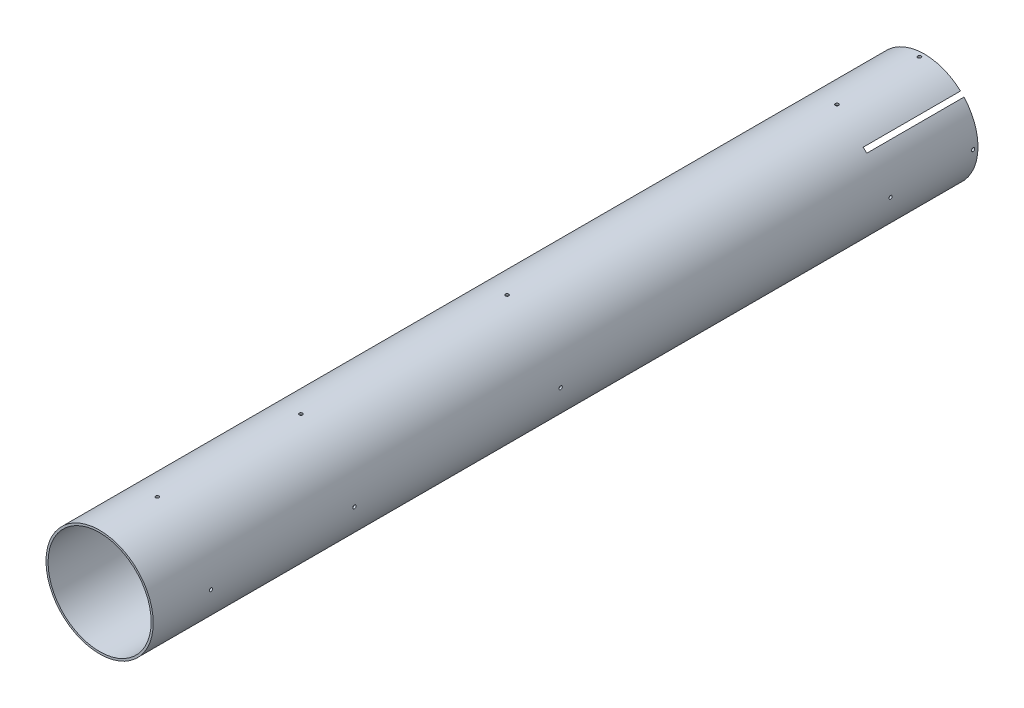
from build123d import *

# Parameters (mm, degrees)
SKETCH1_R           = 65
SKETCH1_R_2         = 62.5
BOSS_EXTRUDE1_DEPTH = 500
SKETCH3_R           = 2
CUT_EXTRUDE2_DEPTH  = 140
SKETCH4_R           = 2
CUT_EXTRUDE3_DEPTH  = 294.5
CUT_EXTRUDE4_DEPTH  = 118
CIRPATTERN1_COUNT   = 4


with BuildPart() as part:
    # Sketch1 → Boss-Extrude1 (new, symmetric)
    with BuildSketch(Plane.XY):
        Circle(SKETCH1_R)
        Circle(SKETCH1_R_2, mode=Mode.SUBTRACT)
    extrude(amount=BOSS_EXTRUDE1_DEPTH, both=True)

    # Sketch3 → Cut-Extrude2 (cut, symmetric)
    with BuildSketch(Plane(origin=(0, 0, 0), x_dir=(1, 0, 0), z_dir=(0, 1, 0))):
        with Locations(Location((0, 494, 0), (0, 0, 270))):
            Circle(SKETCH3_R)
        with Locations(Location((0, 394, 0), (0, 0, 270))):
            Circle(SKETCH3_R)
        with Locations(Location((0, -6, 0), (0, 0, 270))):
            Circle(SKETCH3_R)
        with Locations(Location((0, -256, 0), (0, 0, 270))):
            Circle(SKETCH3_R)
        with Locations(Location((0, -430, 0), (0, 0, 270))):
            Circle(SKETCH3_R)
    extrude(amount=CUT_EXTRUDE2_DEPTH, both=True, mode=Mode.SUBTRACT)

    # Sketch4 → Cut-Extrude3 (cut, symmetric)
    with BuildSketch(Plane(origin=(0, 0, 0), x_dir=(0, 0, -1), z_dir=(1, 0, 0))):
        with Locations((-430, 0)):
            Circle(SKETCH4_R)
        with Locations((-256, 0)):
            Circle(SKETCH4_R)
        with Locations((-6, 0)):
            Circle(SKETCH4_R)
        with Locations((394, 0)):
            Circle(SKETCH4_R)
        with Locations((494, 0)):
            Circle(SKETCH4_R)
    extrude(amount=CUT_EXTRUDE3_DEPTH, both=True, mode=Mode.SUBTRACT)

    # Sketch2 → Cut-Extrude4 (cut)
    with BuildSketch(Plane(origin=(0, 0, -500), x_dir=(-1, 0, 0), z_dir=(0, 0, -1))):
        with BuildLine():
            ThreePointArc((48.034281477, 43.791640789), (45.961940777, 45.961940777), (43.791640789, 48.034281477))
            Line((43.791640789, 48.034281477), (42.021912433, 46.264553121))
            ThreePointArc((42.021912433, 46.264553121), (44.194173824, 44.194173824), (46.264553121, 42.021912433))
            Line((46.264553121, 42.021912433), (48.034281477, 43.791640789))
        make_face()
    cut_extrude4 = extrude(amount=-CUT_EXTRUDE4_DEPTH, mode=Mode.SUBTRACT)

    # CirPattern1: Cut-Extrude4 ×4 about axis
    cirpattern1_axis = Axis((0, 0, 0), (0, 0, 1))
    for i in range(1, CIRPATTERN1_COUNT):
        add(cut_extrude4.rotate(cirpattern1_axis, i * 360 / CIRPATTERN1_COUNT), mode=Mode.SUBTRACT)


solid = part.part
